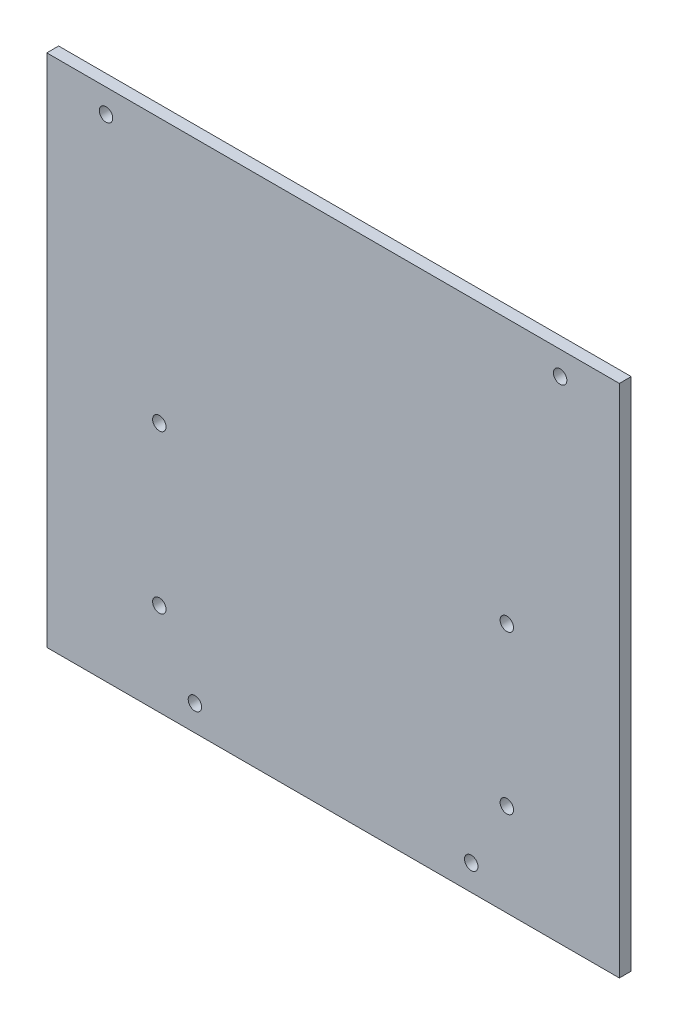
from build123d import *

# Parameters (mm, degrees)
SKETCH1_W             = 145
SKETCH1_H             = 130.4
BOSS_EXTRUDE1_DEPTH   = 3
SKETCH3_R             = 1.7
DEPENDENT_HOLES_DEPTH = 10


with BuildPart() as part:
    # Sketch1 → Boss-Extrude1 (new body)
    with BuildSketch(Plane.XY):
        with Locations((0, 65.2)):
            Rectangle(SKETCH1_W, SKETCH1_H)
    extrude(amount=BOSS_EXTRUDE1_DEPTH)

    # Sketch3 → dependent_holes (cut)
    with BuildSketch(Plane.XY.offset(3)):
        with Locations((-57.5, 124.4)):
            Circle(SKETCH3_R)
        with Locations((57.5, 124.4)):
            Circle(SKETCH3_R)
        with Locations((-44, 63.438804225)):
            Circle(SKETCH3_R)
        with Locations((-44, 23.438804225)):
            Circle(SKETCH3_R)
        with Locations((44, 23.438804225)):
            Circle(SKETCH3_R)
        with Locations((44, 63.438804225)):
            Circle(SKETCH3_R)
        with Locations((-34.9875, 6.5)):
            Circle(SKETCH3_R)
        with Locations((34.9875, 6.5)):
            Circle(SKETCH3_R)
    extrude(amount=-DEPENDENT_HOLES_DEPTH, mode=Mode.SUBTRACT)


solid = part.part
